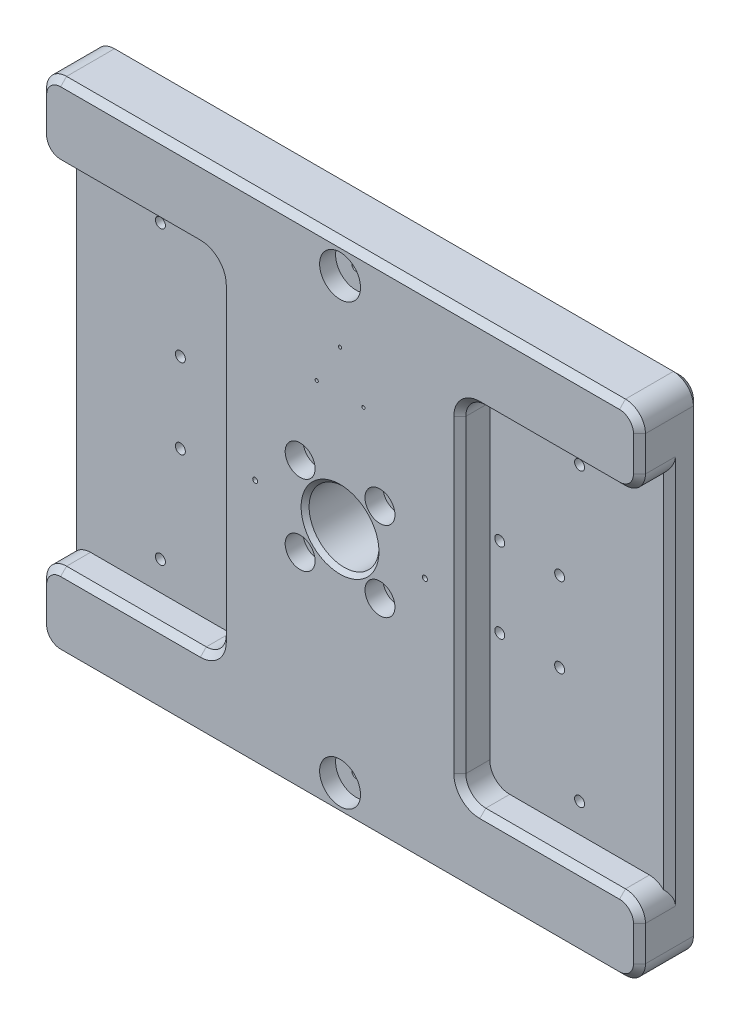
from build123d import *

# Parameters (mm, degrees)
SKETCH_1_W                = 300
SKETCH_1_H                = 250
EXTRUDE_1_DEPTH           = 30
SKETCH_2_W                = 180
SKETCH_2_H                = 175
CUT_EXTRUDE_1_DEPTH       = 15
FILLET_1_R                = 10
HOLE_WIZARD_1_D           = 9
HOLE_WIZARD_1_CBORE_D     = 15
HOLE_WIZARD_1_CBORE_DEPTH = 9
CHAMFER_1_SIZE            = 3
SKETCH_6_R                = 17.5
CUT_EXTRUDE_2_DEPTH       = 198.547462651
CHAMFER_2_SIZE            = 2
HOLE_WIZARD_M6_1_D        = 5
HOLE_WIZARD_M6_1_DEPTH    = 15
HOLE_WIZARD_M6_1_TIP      = 1.502151548
HOLE_WIZARD_M6_2_D        = 5
HOLE_WIZARD_M5_1_D        = 4.2
HOLE_WIZARD_M5_1_DEPTH    = 12.4
HOLE_WIZARD_M5_1_TIP      = 1.2618073
HOLE_WIZARD_M2_1_D        = 1.6
HOLE_WIZARD_M2_1_DEPTH    = 9.2
HOLE_WIZARD_M2_1_TIP      = 0.480688495
HOLE_WIZARD_M3_1_D        = 2.5
HOLE_WIZARD_M3_1_DEPTH    = 9.5
HOLE_WIZARD_M3_1_TIP      = 0.751075774
SKETCH_21_R               = 10.25
CUT_EXTRUDE_3_DEPTH       = 8
HOLE_WIZARD_M5_2_D        = 4.2
HOLE_WIZARD_M5_2_DEPTH    = 12.4
HOLE_WIZARD_M5_2_TIP      = 1.2618073


with BuildPart() as part:
    # 草图1 → 凸台-拉伸1 (new body)
    with BuildSketch(Plane.XY):
        Rectangle(SKETCH_1_W, SKETCH_1_H)
    extrude(amount=EXTRUDE_1_DEPTH)

    # 草图2 → 切除-拉伸1 (cut)
    with BuildSketch(Plane.XY.offset(30)):
        with Locations((-150, 0)):
            Rectangle(SKETCH_2_W, SKETCH_2_H)
        with Locations((150, 0)):
            Rectangle(SKETCH_2_W, SKETCH_2_H)
    extrude(amount=-CUT_EXTRUDE_1_DEPTH, mode=Mode.SUBTRACT)

    # 圆角1
    fillet_1_edges = [part.edges().sort_by_distance(p)[0] for p in [
        (-150, -87.5, 22.5),
        (-60, -87.5, 22.5),
        (-150, 87.5, 22.5),
        (-60, 87.5, 22.5),
        (150, 87.5, 22.5),
        (60, 87.5, 22.5),
        (150, -87.5, 22.5),
        (60, -87.5, 22.5),
        (150, -125, 15),
        (-150, -125, 15),
        (-150, 125, 15),
        (150, 125, 15),
    ]]
    fillet(fillet_1_edges, radius=FILLET_1_R)

    # 打孔尺寸(%根据)内六角圆柱头螺钉的类型1 (through all)
    with Locations(Plane.XY.offset(30)):
        with Locations((-20, 20), (20, 20), (20, -20), (-20, -20)):
            CounterBoreHole(HOLE_WIZARD_1_D / 2, HOLE_WIZARD_1_CBORE_D / 2, HOLE_WIZARD_1_CBORE_DEPTH)

    # 倒角1
    chamfer_1_edges = [part.edges().sort_by_distance(p)[0] for p in [
        (-150, 0, 15),
        (150, 0, 15),
        (0, -125, 0),
        (0, -125, 30),
        (150, 0, 0),
        (-150, 0, 0),
        (0, 125, 0),
        (-147.071067812, 122.071067812, 0),
        (147.071067812, 122.071067812, 0),
        (147.071067812, -122.071067812, 0),
        (-147.071067812, -122.071067812, 0),
        (-150, -106.25, 30),
        (-150, 106.25, 30),
        (-105, -87.5, 30),
        (150, -106.25, 30),
        (105, -87.5, 30),
        (60, 0, 30),
        (105, 87.5, 30),
        (150, 106.25, 30),
        (0, 125, 30),
        (-105, 87.5, 30),
        (-60, 0, 30),
        (-147.071067812, 90.428932188, 30),
        (-147.071067812, -90.428932188, 30),
        (147.071067812, 90.428932188, 30),
        (147.071067812, -90.428932188, 30),
        (-147.071067812, 122.071067812, 30),
        (147.071067812, 122.071067812, 30),
        (147.071067812, -122.071067812, 30),
        (-147.071067812, -122.071067812, 30),
        (62.928932188, -84.571067812, 30),
        (62.928932188, 84.571067812, 30),
        (-62.928932188, -84.571067812, 30),
        (-62.928932188, 84.571067812, 30),
    ]]
    chamfer(chamfer_1_edges, length=CHAMFER_1_SIZE)

    # 草图6 → 切除-拉伸2 (cut, through all)
    with BuildSketch(Plane.XY.offset(30)):
        Circle(SKETCH_6_R)
    extrude(amount=-CUT_EXTRUDE_2_DEPTH, mode=Mode.SUBTRACT)

    # 倒角2
    chamfer_2_edges = [part.edges().sort_by_distance(p)[0] for p in [
        (-17.5, 0, 0),
        (-17.5, 0, 30),
    ]]
    chamfer(chamfer_2_edges, length=CHAMFER_2_SIZE)

    # M6 螺纹孔1
    with Locations(Plane(origin=(0, 0, 0), x_dir=(-1, 0, 0), z_dir=(0, 0, -1))):
        with Locations((-20, 95), (20, -95), (-20, -95), (-20, -65), (20, -65), (65, -20), (95, -20), (95, 20), (65, 20), (-65, -20), (-95, -20), (-95, 20), (-65, 20), (20, 65), (20, 95), (-20, 65)):
            Hole(HOLE_WIZARD_M6_1_D / 2, depth=HOLE_WIZARD_M6_1_DEPTH)
            with Locations((0, 0, -(HOLE_WIZARD_M6_1_DEPTH + HOLE_WIZARD_M6_1_TIP / 2))):  # 118° drill point
                Cone(0, HOLE_WIZARD_M6_1_D / 2, HOLE_WIZARD_M6_1_TIP, mode=Mode.SUBTRACT)

    # M6 螺纹孔2 (through all)
    with Locations(Plane.XY.offset(15)):
        with Locations((-105, 73), (-105, -73), (105, 73), (105, -73)):
            Hole(HOLE_WIZARD_M6_2_D / 2)

    # M5 螺纹孔1
    with Locations(Plane(origin=(0, -125, 0), x_dir=(-1, 0, 0), z_dir=(0, -1, 0))):
        with Locations((65, -15), (-65, -15)):
            Hole(HOLE_WIZARD_M5_1_D / 2, depth=HOLE_WIZARD_M5_1_DEPTH)
            with Locations((0, 0, -(HOLE_WIZARD_M5_1_DEPTH + HOLE_WIZARD_M5_1_TIP / 2))):  # 118° drill point
                Cone(0, HOLE_WIZARD_M5_1_D / 2, HOLE_WIZARD_M5_1_TIP, mode=Mode.SUBTRACT)

    # M2 螺纹孔1
    with Locations(Plane.XY.offset(30)):
        with Locations((11.691342951, 58.75), (0, 79), (-11.691342951, 58.75)):
            Hole(HOLE_WIZARD_M2_1_D / 2, depth=HOLE_WIZARD_M2_1_DEPTH)
            with Locations((0, 0, -(HOLE_WIZARD_M2_1_DEPTH + HOLE_WIZARD_M2_1_TIP / 2))):  # 118° drill point
                Cone(0, HOLE_WIZARD_M2_1_D / 2, HOLE_WIZARD_M2_1_TIP, mode=Mode.SUBTRACT)

    # M3 螺纹孔1
    with Locations(Plane.XY.offset(30)):
        with Locations((-42.5, 0), (42.5, 0)):
            Hole(HOLE_WIZARD_M3_1_D / 2, depth=HOLE_WIZARD_M3_1_DEPTH)
            with Locations((0, 0, -(HOLE_WIZARD_M3_1_DEPTH + HOLE_WIZARD_M3_1_TIP / 2))):  # 118° drill point
                Cone(0, HOLE_WIZARD_M3_1_D / 2, HOLE_WIZARD_M3_1_TIP, mode=Mode.SUBTRACT)

    # 草图21 → 切除-拉伸3 (cut)
    with BuildSketch(Plane.XY.offset(30)):
        with Locations((0, 110)):
            Circle(SKETCH_21_R)
        with Locations((0, -110)):
            Circle(SKETCH_21_R)
    extrude(amount=-CUT_EXTRUDE_3_DEPTH, mode=Mode.SUBTRACT)

    # M5 螺纹孔2
    with Locations(Plane.XY.offset(22)):
        with Locations((0, -110), (0, 110)):
            Hole(HOLE_WIZARD_M5_2_D / 2, depth=HOLE_WIZARD_M5_2_DEPTH)
            with Locations((0, 0, -(HOLE_WIZARD_M5_2_DEPTH + HOLE_WIZARD_M5_2_TIP / 2))):  # 118° drill point
                Cone(0, HOLE_WIZARD_M5_2_D / 2, HOLE_WIZARD_M5_2_TIP, mode=Mode.SUBTRACT)


solid = part.part
